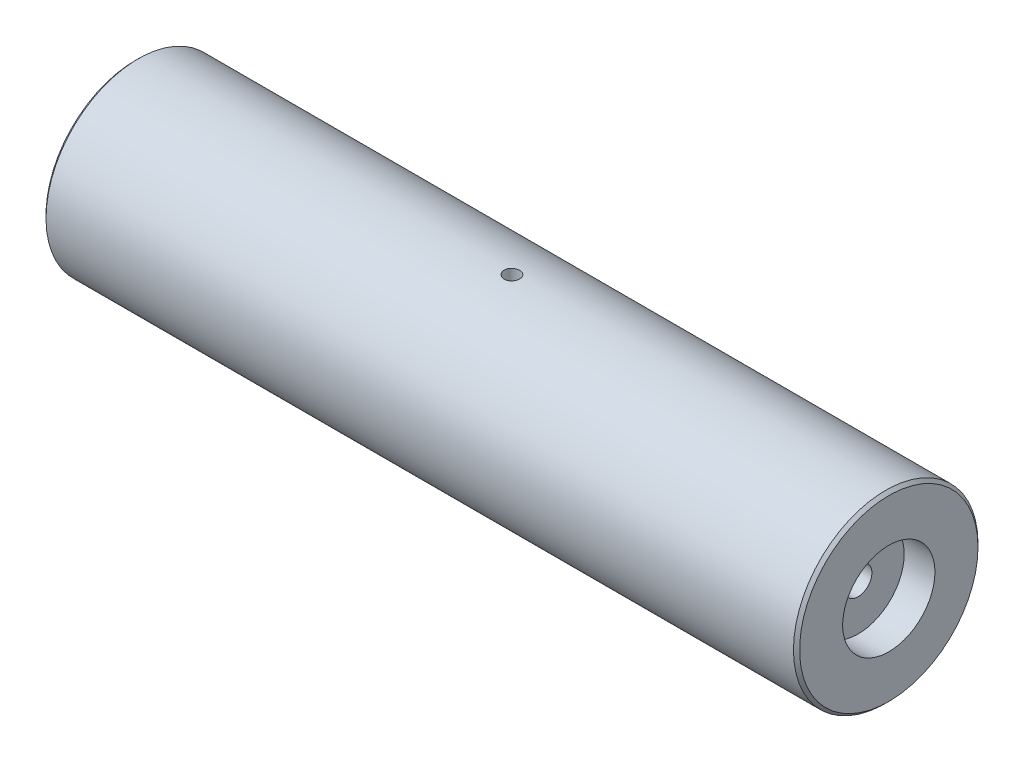
from build123d import *

# Parameters (mm, degrees)
SKETCH_1_R                = 30
EXTRUDE_1_DEPTH           = 245
CHAMFER_1_SIZE            = 1
SKETCH_2_R                = 15
CUT_EXTRUDE_1_DEPTH       = 10
HOLE_WIZARD_8_0_8_1_D     = 8
HOLE_WIZARD_8_0_8_1_DEPTH = 117.5
HOLE_WIZARD_8_0_8_1_TIP   = 2.403442476
M10X1_0_1_D               = 9
M10X1_0_1_DEPTH           = 20
M10X1_0_1_TIP             = 2.703872786
HOLE_WIZARD_5_0_5_1_D     = 5
HOLE_WIZARD_5_0_5_1_DEPTH = 30
HOLE_WIZARD_5_0_5_1_TIP   = 1.502151548


with BuildPart() as part:
    # 草图1 → 凸台-拉伸1 (new body)
    with BuildSketch(Plane(origin=(0, 0, 0), x_dir=(0, 0, -1), z_dir=(1, 0, 0))):
        Circle(SKETCH_1_R)
    extrude(amount=EXTRUDE_1_DEPTH)

    # 倒角1
    chamfer_1_edges = [part.edges().sort_by_distance(p)[0] for p in [
        (0, 0, 30),
        (245, 0, 30),
    ]]
    chamfer(chamfer_1_edges, length=CHAMFER_1_SIZE)

    # 草图2 → 切除-拉伸1 (cut)
    with BuildSketch(Plane(origin=(245, 0, 0), x_dir=(0, 0, -1), z_dir=(1, 0, 0))):
        Circle(SKETCH_2_R)
    extrude(amount=-CUT_EXTRUDE_1_DEPTH, mode=Mode.SUBTRACT)

    # Ø8.0 (8) 直径孔1
    with Locations(Plane(origin=(235, 0, 0), x_dir=(0, 0, -1), z_dir=(1, 0, 0))):
        with Locations((0, 0)):
            Hole(HOLE_WIZARD_8_0_8_1_D / 2, depth=HOLE_WIZARD_8_0_8_1_DEPTH)
            with Locations((0, 0, -(HOLE_WIZARD_8_0_8_1_DEPTH + HOLE_WIZARD_8_0_8_1_TIP / 2))):  # 118° drill point
                Cone(0, HOLE_WIZARD_8_0_8_1_D / 2, HOLE_WIZARD_8_0_8_1_TIP, mode=Mode.SUBTRACT)

    # M10x1.0 螺纹孔1
    with Locations(Plane(origin=(235, 0, 0), x_dir=(0, 0, -1), z_dir=(1, 0, 0))):
        with Locations((0, 0)):
            Hole(M10X1_0_1_D / 2, depth=M10X1_0_1_DEPTH)
            with Locations((0, 0, -(M10X1_0_1_DEPTH + M10X1_0_1_TIP / 2))):  # 118° drill point
                Cone(0, M10X1_0_1_D / 2, M10X1_0_1_TIP, mode=Mode.SUBTRACT)

    # Ø5.0 (5) 直径孔1
    with Locations(Plane(origin=(0, 30, 0), x_dir=(1, 0, 0), z_dir=(0, 1, 0))):
        with Locations((122.5, 0)):
            Hole(HOLE_WIZARD_5_0_5_1_D / 2, depth=HOLE_WIZARD_5_0_5_1_DEPTH)
            with Locations((0, 0, -(HOLE_WIZARD_5_0_5_1_DEPTH + HOLE_WIZARD_5_0_5_1_TIP / 2))):  # 118° drill point
                Cone(0, HOLE_WIZARD_5_0_5_1_D / 2, HOLE_WIZARD_5_0_5_1_TIP, mode=Mode.SUBTRACT)


solid = part.part
